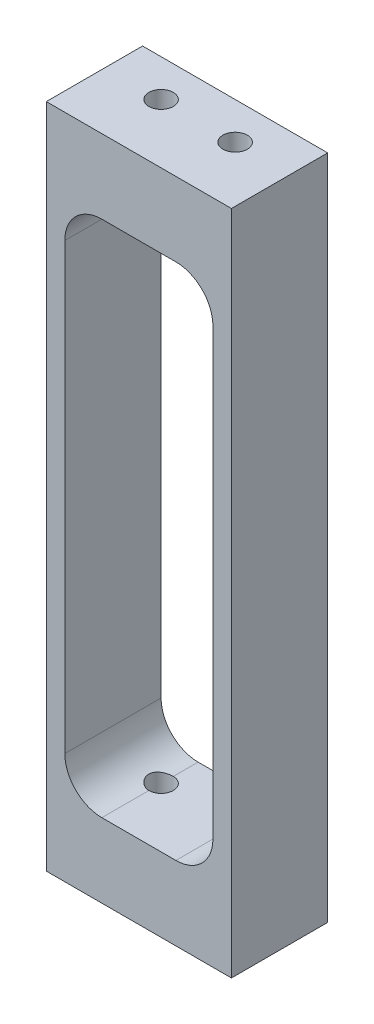
from build123d import *

# Parameters (mm, degrees)
SKETCH1_W             = 25
SKETCH1_H             = 90
BOSS_EXTRUDE1_DEPTH   = 13
SKETCH2_W             = 20
SKETCH2_H             = 70
CUT_EXTRUDE1_DEPTH    = 23
FILLET1_R             = 5
M4X0_7_TAPPED_HOLE1_D = 3.3


with BuildPart() as part:
    # Sketch1 → Boss-Extrude1 (new body)
    with BuildSketch(Plane.XY):
        Rectangle(SKETCH1_W, SKETCH1_H)
    extrude(amount=BOSS_EXTRUDE1_DEPTH)

    # Sketch2 → Cut-Extrude1 (cut)
    with BuildSketch(Plane.XY.offset(13)):
        Rectangle(SKETCH2_W, SKETCH2_H)
    extrude(amount=-CUT_EXTRUDE1_DEPTH, mode=Mode.SUBTRACT)

    # Fillet1
    fillet1_edges = [part.edges().sort_by_distance(p)[0] for p in [
        (10, 35, 6.5),
        (10, -35, 6.5),
        (-10, -35, 6.5),
        (-10, 35, 6.5),
    ]]
    fillet(fillet1_edges, radius=FILLET1_R)

    # M4x0.7 Tapped Hole1 (through all)
    with Locations(Plane(origin=(0, -45, 0), x_dir=(-1, 0, 0), z_dir=(0, -1, 0))):
        with Locations((-5, -5), (5, -5)):
            Hole(M4X0_7_TAPPED_HOLE1_D / 2)


solid = part.part
